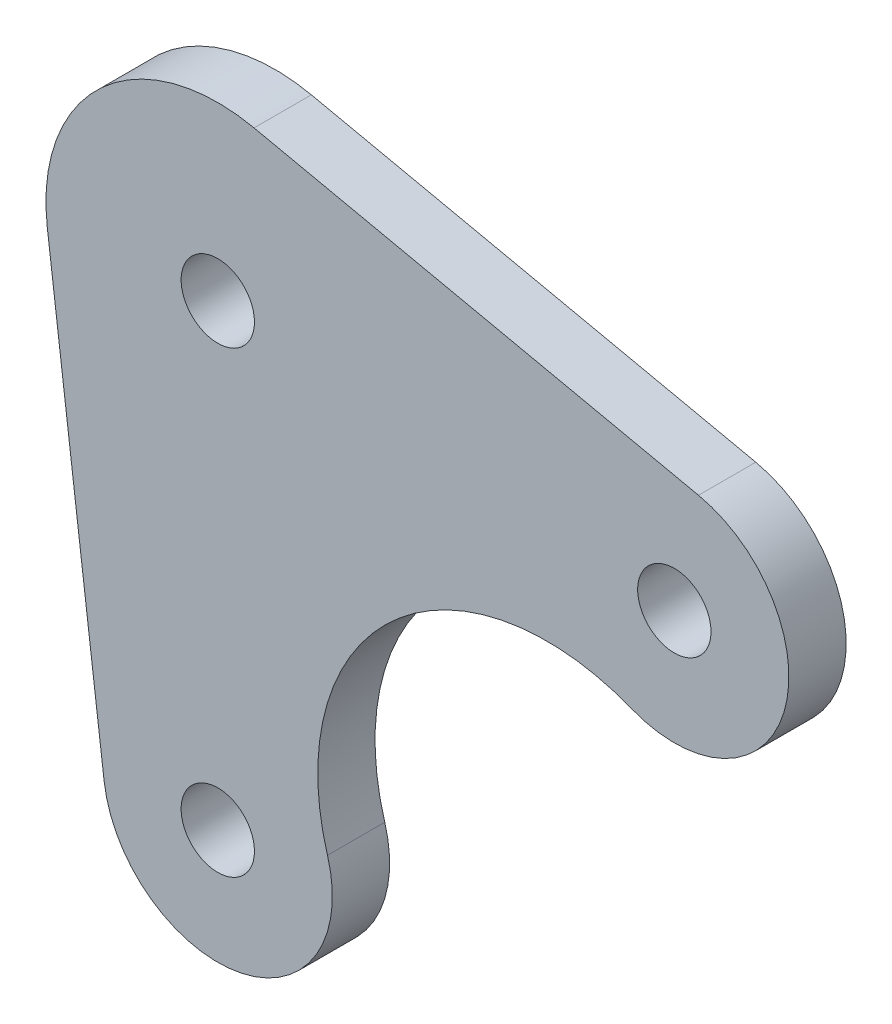
from build123d import *

# Parameters (mm, degrees)
SKETCH1_R           = 2.032
BOSS_EXTRUDE1_DEPTH = 3.175


with BuildPart() as part:
    # Sketch1 → Boss-Extrude1 (new body)
    with BuildSketch(Plane.XY):
        with BuildLine():
            Line((-6.300195309, -26.19375), (-9.450292964, -1.190625))
            ThreePointArc((-9.450292964, -1.190625), (-6.434996728, 7.022566633), (2.009741615, 9.31056194))
            Line((2.009741615, 9.31056194), (26.643173075, 3.993285428))
            ThreePointArc((26.643173075, 3.993285428), (31.376812055, -4.067266578), (22.949101168, -8.111215863))
            ThreePointArc((22.949101168, -8.111215863), (9.660617203, -10.542713679), (6.08020428, -23.568711952))
            ThreePointArc((6.08020428, -23.568711952), (1.317120041, -31.611899452), (-6.300195309, -26.19375))
        make_face()
        Circle(SKETCH1_R, mode=Mode.SUBTRACT)
        with Locations((25.303345332, -2.213755866)):
            Circle(SKETCH1_R, mode=Mode.SUBTRACT)
        with Locations((0, -25.4)):
            Circle(SKETCH1_R, mode=Mode.SUBTRACT)
    extrude(amount=BOSS_EXTRUDE1_DEPTH)


solid = part.part
